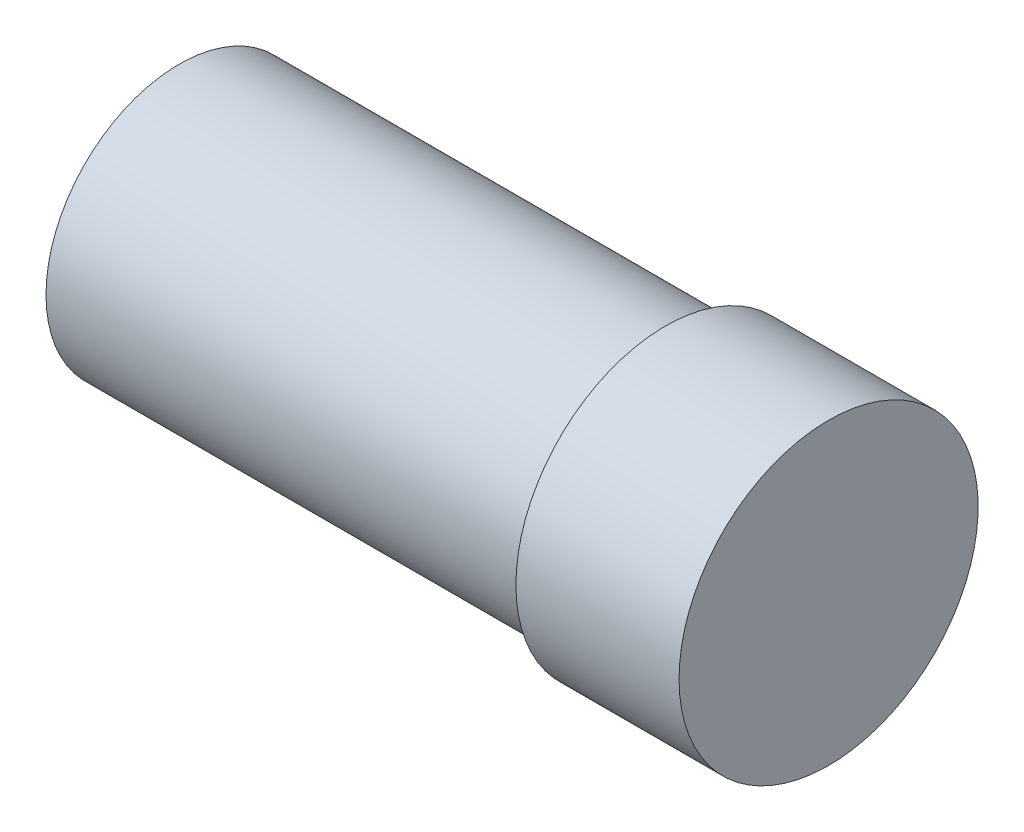
from build123d import *


with BuildPart() as part:
    # Sketch1 → Revolve1 (revolve)
    with BuildSketch(Plane.XY, mode=Mode.PRIVATE) as revolve1_sk:
        Polygon((-22.35, 12.25), (-22.35, 0), (37.35, 0), (37.35, 13.75), (22.35, 13.75), (22.35, 12.25), align=None)
    revolve(revolve1_sk.sketch.rotate(Axis((-22.35, 0, 0), (1, 0, 0)), 90), axis=Axis((-22.35, 0, 0), (1, 0, 0)))


solid = part.part
